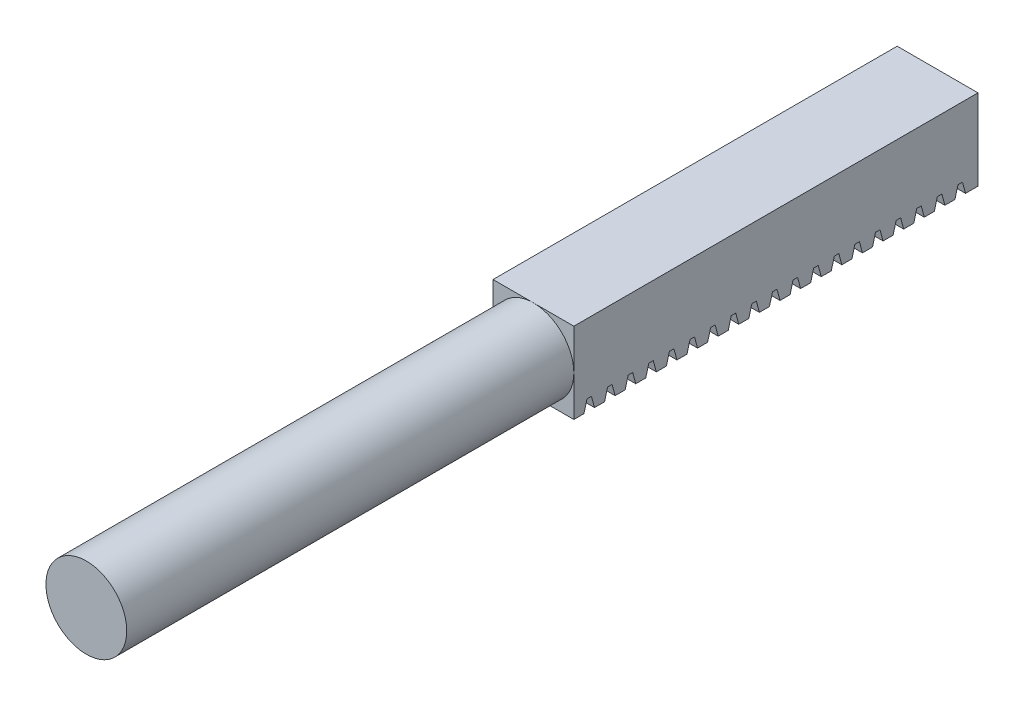
from build123d import *

# Parameters (mm, degrees)
CROQUIS1_W              = 8
CROQUIS1_H              = 8
EXTRUIR1_DEPTH          = 40
CORTAR_EXTRUIR3_DEPTH   = 8
CROQUIS5_R              = 4
SALIENTE_EXTRUIR1_DEPTH = 44.25


with BuildPart() as part:
    # Croquis1 → Extruir1 (new body)
    with BuildSketch(Plane.XY):
        Rectangle(CROQUIS1_W, CROQUIS1_H)
    extrude(amount=EXTRUIR1_DEPTH)

    # Croquis4 → Cortar-Extruir3 (cut)
    with BuildSketch(Plane(origin=(4, 0, 0), x_dir=(0, 0, -1), z_dir=(1, 0, 0))):
        Polygon((-36.96, -4), (-36.6612042, -2.884878893), (-36.21598653, -2.884878893), (-35.91719073, -4), align=None)
        Polygon((-39, -4), (-38.7012042, -2.884878893), (-38.25598653, -2.884878893), (-37.95719073, -4), align=None)
        Polygon((-34.92, -4), (-34.6212042, -2.884878893), (-34.17598653, -2.884878893), (-33.87719073, -4), align=None)
        Polygon((-32.88, -4), (-32.5812042, -2.884878893), (-32.13598653, -2.884878893), (-31.83719073, -4), align=None)
        Polygon((-30.84, -4), (-30.5412042, -2.884878893), (-30.09598653, -2.884878893), (-29.79719073, -4), align=None)
        Polygon((-28.8, -4), (-28.5012042, -2.884878893), (-28.05598653, -2.884878893), (-27.75719073, -4), align=None)
        Polygon((-26.76, -4), (-26.4612042, -2.884878893), (-26.01598653, -2.884878893), (-25.71719073, -4), align=None)
        Polygon((-24.72, -4), (-24.4212042, -2.884878893), (-23.97598653, -2.884878893), (-23.67719073, -4), align=None)
        Polygon((-22.68, -4), (-22.3812042, -2.884878893), (-21.93598653, -2.884878893), (-21.63719073, -4), align=None)
        Polygon((-20.64, -4), (-20.3412042, -2.884878893), (-19.89598653, -2.884878893), (-19.59719073, -4), align=None)
        Polygon((-18.6, -4), (-18.3012042, -2.884878893), (-17.85598653, -2.884878893), (-17.55719073, -4), align=None)
        Polygon((-16.56, -4), (-16.2612042, -2.884878893), (-15.81598653, -2.884878893), (-15.51719073, -4), align=None)
        Polygon((-14.52, -4), (-14.2212042, -2.884878893), (-13.77598653, -2.884878893), (-13.47719073, -4), align=None)
        Polygon((-12.48, -4), (-12.1812042, -2.884878893), (-11.73598653, -2.884878893), (-11.43719073, -4), align=None)
        Polygon((-10.44, -4), (-10.1412042, -2.884878893), (-9.69598653, -2.884878893), (-9.39719073, -4), align=None)
        Polygon((-8.4, -4), (-8.1012042, -2.884878893), (-7.65598653, -2.884878893), (-7.35719073, -4), align=None)
        Polygon((-6.36, -4), (-6.0612042, -2.884878893), (-5.61598653, -2.884878893), (-5.31719073, -4), align=None)
        Polygon((-4.32, -4), (-4.0212042, -2.884878893), (-3.57598653, -2.884878893), (-3.27719073, -4), align=None)
        Polygon((-2.28, -4), (-1.9812042, -2.884878893), (-1.53598653, -2.884878893), (-1.23719073, -4), align=None)
    extrude(amount=-CORTAR_EXTRUIR3_DEPTH, mode=Mode.SUBTRACT)

    # Croquis5 → Saliente-Extruir1 (add)
    with BuildSketch(Plane.XY.offset(40)):
        Circle(CROQUIS5_R)
    extrude(amount=SALIENTE_EXTRUIR1_DEPTH)


solid = part.part
